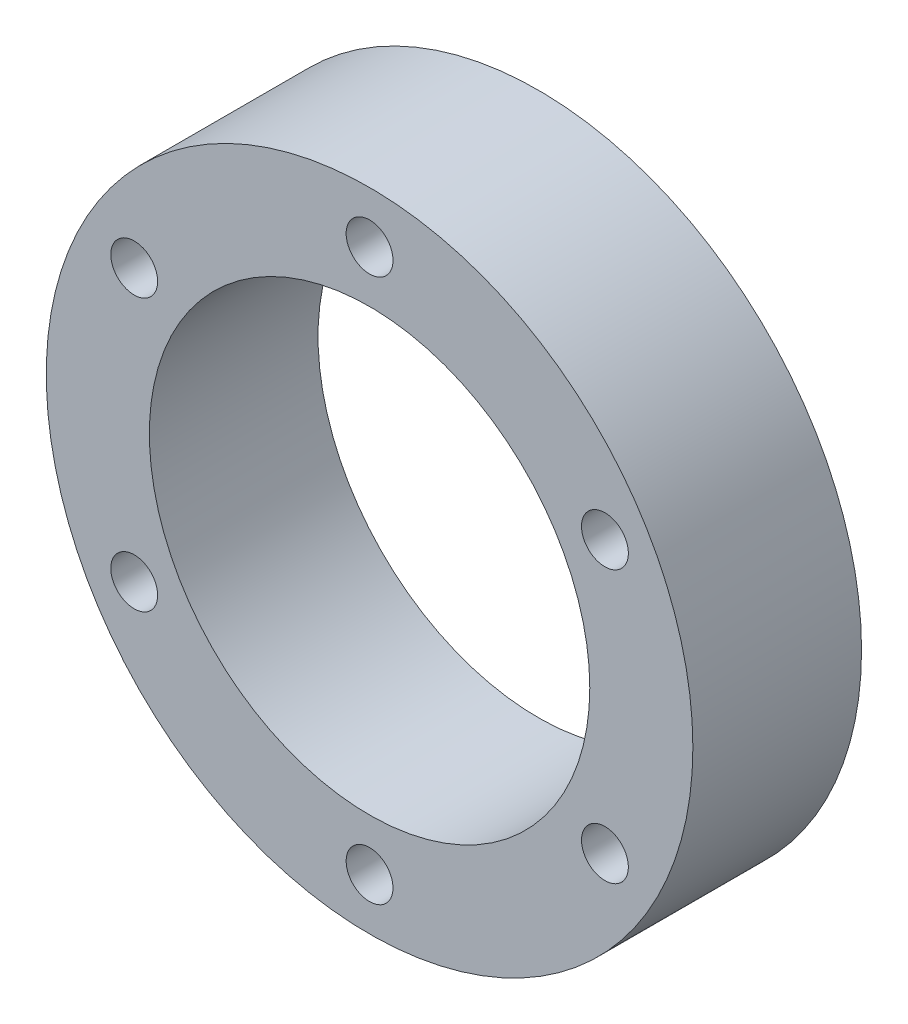
from build123d import *

# Parameters (mm, degrees)
SKETCH1_R          = 34.5
SKETCH1_R_2        = 23.5
BODY_DEPTH         = 18
SKETCH2_R          = 2.5
BOLT_HOLE_DEPTH    = 53.00480747
BOLT_PATTERN_COUNT = 6


with BuildPart() as part:
    # Sketch1 → Body (new body)
    with BuildSketch(Plane.XY):
        Circle(SKETCH1_R)
        Circle(SKETCH1_R_2, mode=Mode.SUBTRACT)
    extrude(amount=BODY_DEPTH)

    # Sketch2 → Bolt Hole (cut, through all)
    with BuildSketch(Plane.XY.offset(18)):
        with Locations((0, 29)):
            Circle(SKETCH2_R)
    bolt_hole = extrude(amount=-BOLT_HOLE_DEPTH, mode=Mode.SUBTRACT)

    # Bolt Pattern: Bolt Hole ×6 about axis
    bolt_pattern_axis = Axis((0, 0, 0), (0, 0, 1))
    for i in range(1, BOLT_PATTERN_COUNT):
        add(bolt_hole.rotate(bolt_pattern_axis, i * 360 / BOLT_PATTERN_COUNT), mode=Mode.SUBTRACT)


solid = part.part
